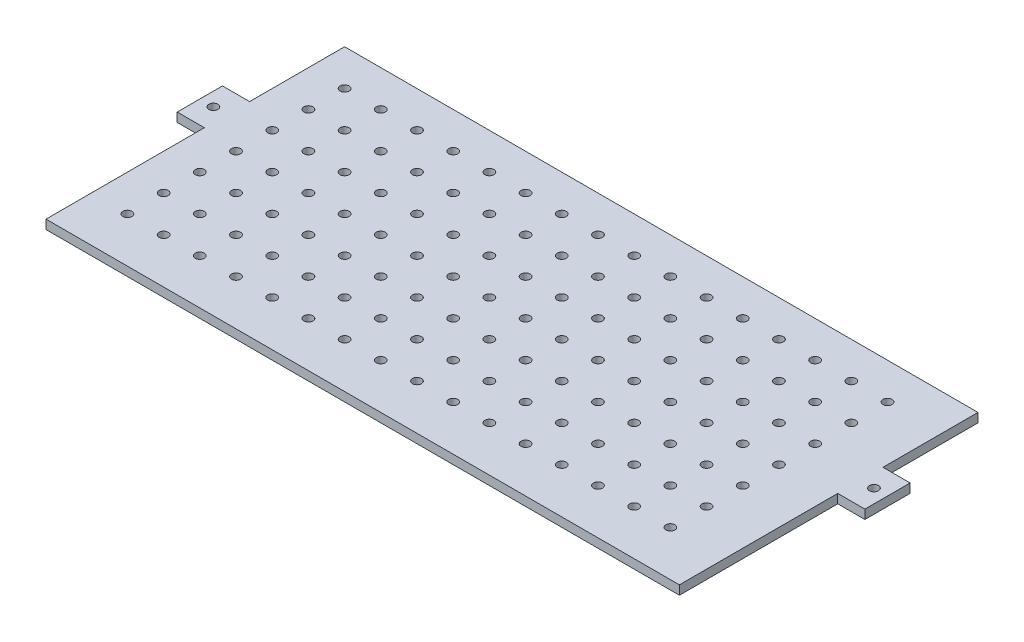
from build123d import *

# Parameters (mm, degrees)
CROQUIS3_W              = 700
CROQUIS3_H              = 300
CROQUIS3_H_2            = 30
CROQUIS3_W_2            = 30
CROQUIS3_H_3            = 50
SALIENTE_EXTRUIR1_DEPTH = 10
CROQUIS5_R              = 5
CORTAR_EXTRUIR1_DEPTH   = 10
MATRIZL1_COUNT          = 16
MATRIZL1_PITCH          = 40
MATRIZL1_COUNT_DIR2     = 7
MATRIZL1_PITCH_DIR2     = 40
CROQUIS6_R              = 5
CORTAR_EXTRUIR2_DEPTH   = 10


with BuildPart() as part:
    # Croquis3 → Saliente-Extruir1 (new body)
    with BuildSketch(Plane(origin=(0, 0, 0), x_dir=(1, 0, 0), z_dir=(0, 1, 0))):
        Rectangle(CROQUIS3_W, CROQUIS3_H)
        with Locations((0, -165)):
            Rectangle(CROQUIS3_W, CROQUIS3_H_2)
        with Locations((365, 20)):
            Rectangle(CROQUIS3_W_2, CROQUIS3_H_3)
        with Locations((-365, 20)):
            Rectangle(CROQUIS3_W_2, CROQUIS3_H_3)
    extrude(amount=SALIENTE_EXTRUIR1_DEPTH)

    # Croquis5 → Cortar-Extruir1 (cut)
    with BuildSketch(Plane(origin=(0, 10, 0), x_dir=(1, 0, 0), z_dir=(0, 1, 0))):
        with Locations(Location((-310, 110, 0), (0, 0, 270))):
            Circle(CROQUIS5_R)
    cortar_extruir1 = extrude(amount=-CORTAR_EXTRUIR1_DEPTH, mode=Mode.SUBTRACT)

    # MatrizL1: Cortar-Extruir1 16 × 7
    with Locations(*[(i * MATRIZL1_PITCH, 0, j * MATRIZL1_PITCH_DIR2) for i in range(MATRIZL1_COUNT) for j in range(MATRIZL1_COUNT_DIR2) if (i, j) != (0, 0)]):
        add(cortar_extruir1, mode=Mode.SUBTRACT)

    # Croquis6 → Cortar-Extruir2 (cut)
    with BuildSketch(Plane(origin=(0, 10, 0), x_dir=(1, 0, 0), z_dir=(0, 1, 0))):
        with Locations(Location((-365, 20, 0), (0, 0, 270))):
            Circle(CROQUIS6_R)
        with Locations(Location((365, 20, 0), (0, 0, 270))):
            Circle(CROQUIS6_R)
    extrude(amount=-CORTAR_EXTRUIR2_DEPTH, mode=Mode.SUBTRACT)


solid = part.part
